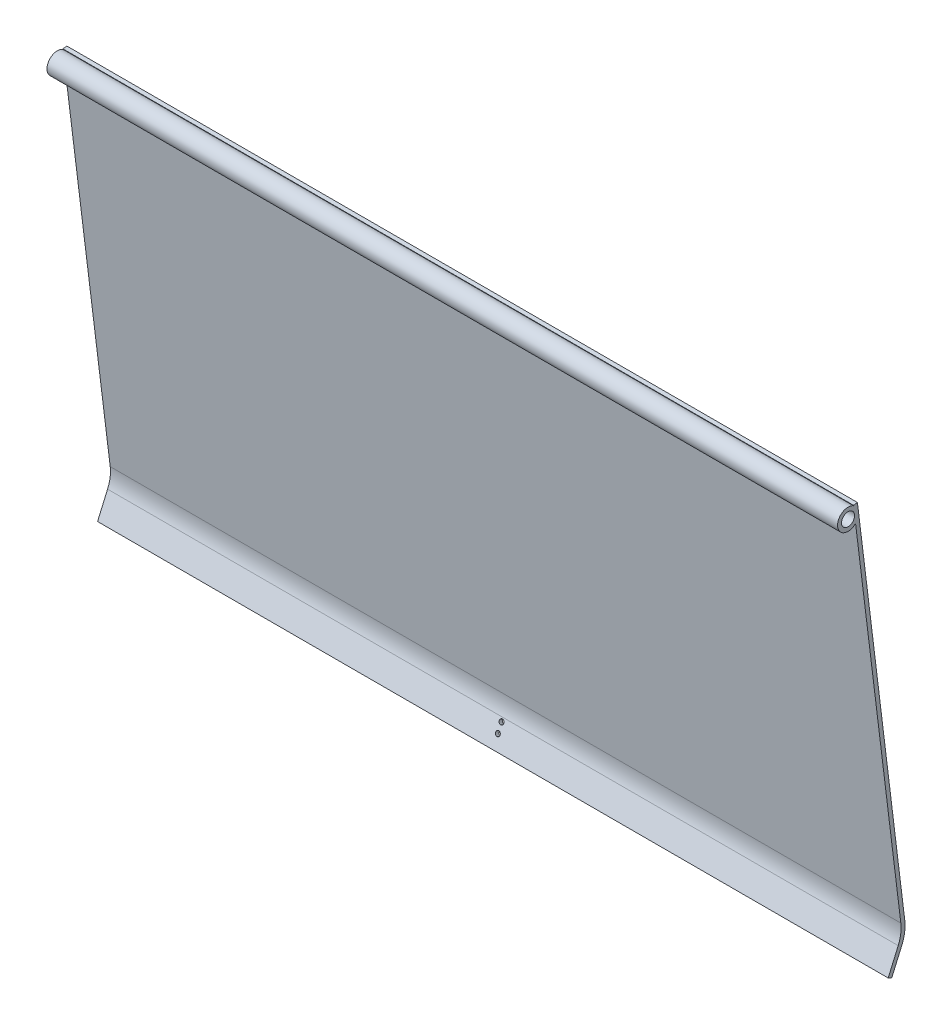
from build123d import *

# Parameters (mm, degrees)
SKETCH2_R        = 4.967627027
MAIN_DEPTH       = 300
SCREW_HOLE_REACH = 387.023
SKETCH3_R        = 1.75


with BuildPart() as part:
    # Sketch2 → Main (new, symmetric)
    with BuildSketch(Plane(origin=(0, 0, 0), x_dir=(0, 0, -1), z_dir=(1, 0, 0))):
        with BuildLine():
            Line((-418.365390033, 66.409688449), (-415.614602943, 65.212537504))
            Line((-415.614602943, 65.212537504), (-408.006110333, 82.695164353))
            ThreePointArc((-408.006110333, 82.695164353), (-405.861496509, 90.229320908), (-405.775405247, 98.062294273))
            Line((-405.775405247, 98.062294273), (-441.695942664, 390.611594874))
            Line((-441.695942664, 390.611594874), (-444.673581118, 390.245986843))
            Line((-444.673581118, 390.245986843), (-444.632221398, 389.90913895))
            ThreePointArc((-444.632221398, 389.90913895), (-456.711881838, 382.149734123), (-443.113869014, 377.543151133))
            Line((-443.113869014, 377.543151133), (-408.753043702, 97.696686242))
            ThreePointArc((-408.753043702, 97.696686242), (-408.83037992, 90.66028644), (-410.756897423, 83.892315298))
            Line((-410.756897423, 83.892315298), (-418.365390033, 66.409688449))
        make_face()
        with Locations((-448.803644294, 383.120743597)):
            Circle(SKETCH2_R, mode=Mode.SUBTRACT)
    extrude(amount=MAIN_DEPTH, both=True)

    # Sketch3 → Screw Hole (cut, up to next)
    with BuildSketch(Plane(origin=(0, 163.655393922, 376.043761949), x_dir=(1, 0, 0), z_dir=(0, 0.3990503148824781, 0.9169290300738631)), mode=Mode.PRIVATE) as screw_hole_sk1:
        with Locations((0, -96.522619686)):
            Circle(SKETCH3_R)
    screw_hole_tool1 = extrude(screw_hole_sk1.sketch, amount=-SCREW_HOLE_REACH, mode=Mode.PRIVATE) & part.part
    # Sketch3 → Screw Hole (cut, up to next)
    with BuildSketch(Plane(origin=(0, 163.655393922, 376.043761949), x_dir=(1, 0, 0), z_dir=(0, 0.3990503148824781, 0.9169290300738631)), mode=Mode.PRIVATE) as screw_hole_sk2:
        with Locations((0, -89.666587201)):
            Circle(SKETCH3_R)
    screw_hole_tool2 = extrude(screw_hole_sk2.sketch, amount=-SCREW_HOLE_REACH, mode=Mode.PRIVATE) & part.part
    add(screw_hole_tool1.solids().sort_by_distance((0, 75.151002, 414.561144))[0], mode=Mode.SUBTRACT)
    add(screw_hole_tool2.solids().sort_by_distance((0, 81.437497, 411.825242))[0], mode=Mode.SUBTRACT)


solid = part.part
